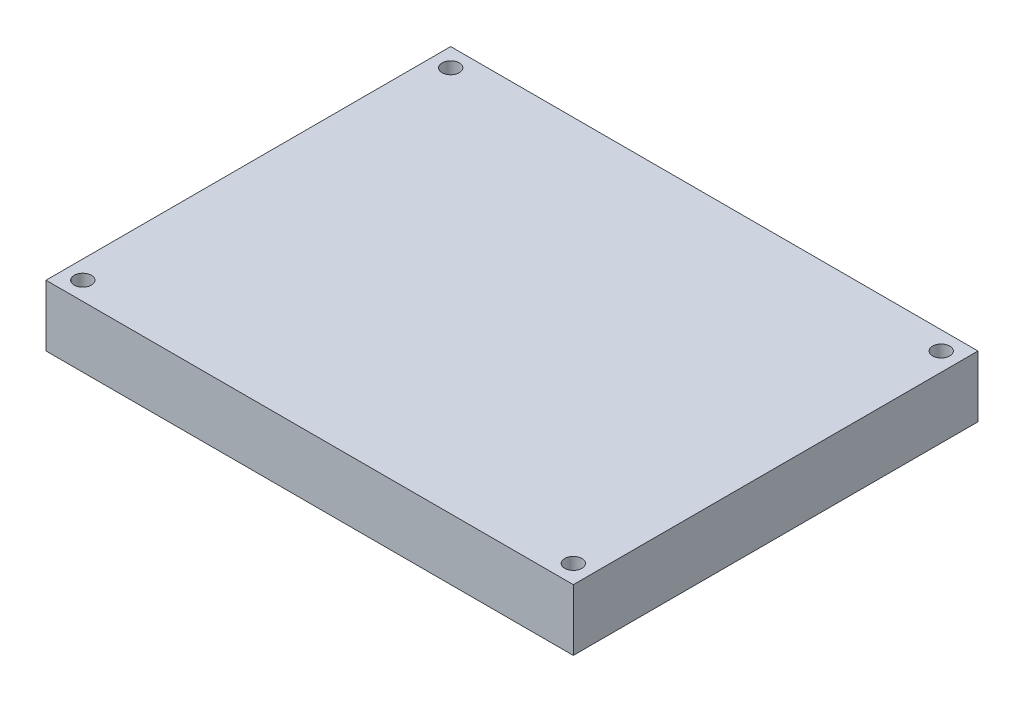
from build123d import *

# Parameters (mm, degrees)
SKETCH_1_W          = 86
SKETCH_1_H          = 66
EXTRUDE_1_DEPTH     = 10
SKETCH_2_R          = 1.4
CUT_EXTRUDE_1_DEPTH = 56.118055118


with BuildPart() as part:
    # 草图1 → 凸台-拉伸1 (new body)
    with BuildSketch(Plane(origin=(0, 0, 0), x_dir=(1, 0, 0), z_dir=(0, 1, 0))):
        Rectangle(SKETCH_1_W, SKETCH_1_H)
    extrude(amount=EXTRUDE_1_DEPTH)

    # 草图2 → 切除-拉伸1 (cut, through all)
    with BuildSketch(Plane(origin=(0, 10, 0), x_dir=(1, 0, 0), z_dir=(0, 1, 0))):
        with Locations(Location((-40, 30, 0), (0, 0, 270))):
            Circle(SKETCH_2_R)
        with Locations(Location((40, 30, 0), (0, 0, 90))):
            Circle(SKETCH_2_R)
        with Locations(Location((40, -30, 0), (0, 0, 270))):
            Circle(SKETCH_2_R)
        with Locations(Location((-40, -30, 0), (0, 0, 90))):
            Circle(SKETCH_2_R)
    extrude(amount=-CUT_EXTRUDE_1_DEPTH, mode=Mode.SUBTRACT)


solid = part.part
